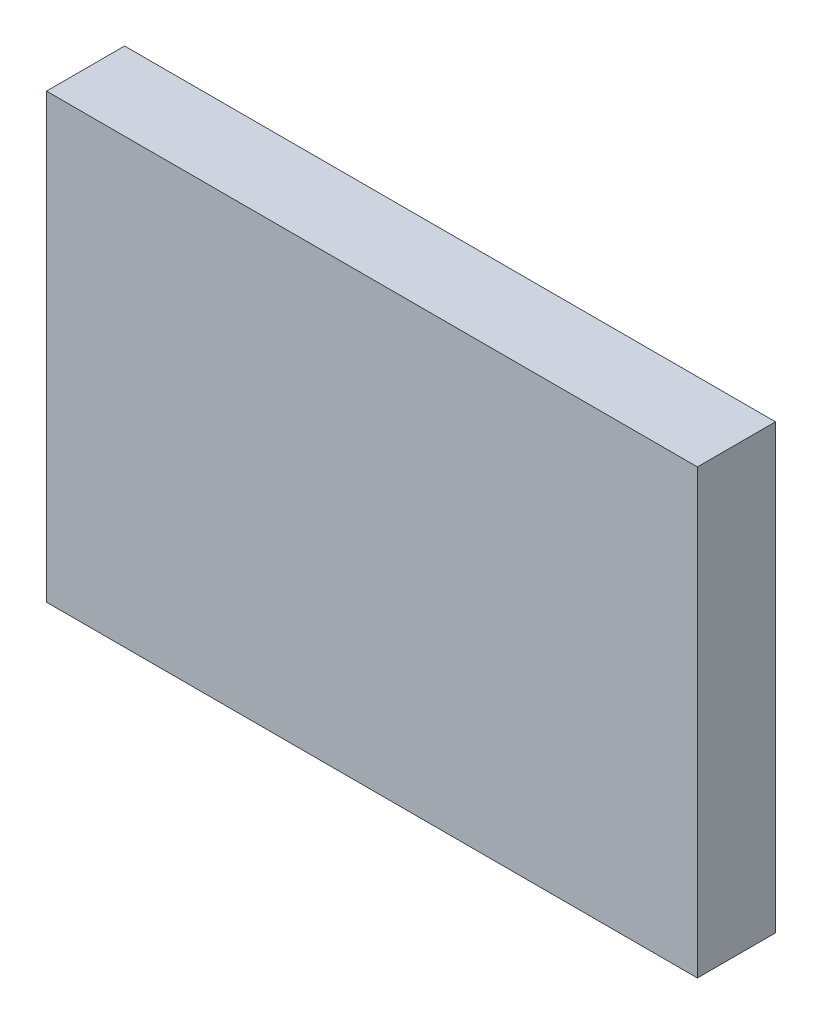
from build123d import *

# Parameters (mm, degrees)
ESBO_O1_W                = 125
ESBO_O1_H                = 85
RESSALTO_EXTRUS_O1_DEPTH = 15


with BuildPart() as part:
    # Esboço1 → Ressalto-extrusão1 (new body)
    with BuildSketch(Plane.XY):
        Rectangle(ESBO_O1_W, ESBO_O1_H)
    extrude(amount=RESSALTO_EXTRUS_O1_DEPTH)


solid = part.part
